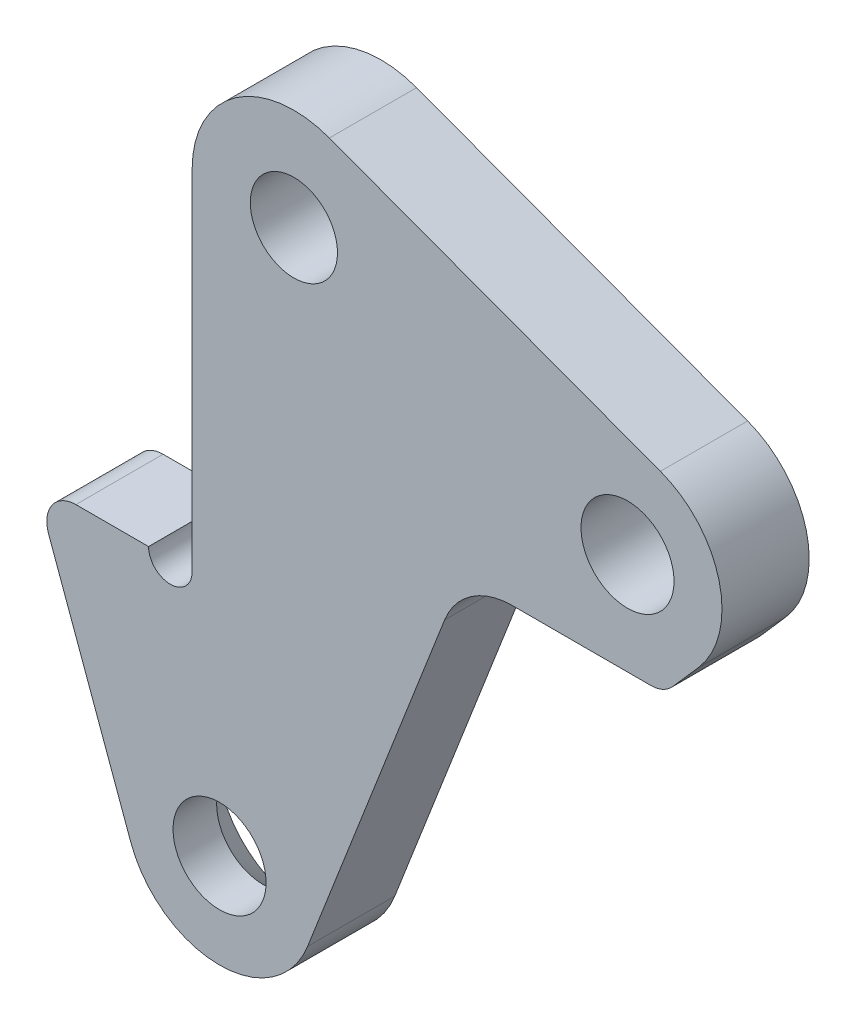
from build123d import *

# Parameters (mm, degrees)
SKETCH_1_R          = 1.5
SKETCH_1_R_2        = 1.6
EXTRUDE_1_DEPTH     = 1.5
CHAMFER_1_SIZE      = 1.5
SKETCH_2_R          = 0.75
CUT_EXTRUDE_1_DEPTH = 28.684874976
CUT_EXTRUDE_2_DEPTH = 28.684874976
FILLET_1_R          = 2.5
FILLET_2_R          = 1


with BuildPart() as part:
    # 草图1 → 凸台-拉伸1 (new, symmetric)
    with BuildSketch(Plane.XY):
        with BuildLine():
            Line((-7.5, -12), (-3.5, -12))
            Line((-3.5, -12), (-3.5, 0))
            ThreePointArc((-3.5, 0), (-1.997674375, 2.873899283), (1.219598337, 3.280637117))
            Line((1.219598337, 3.280637117), (12.609663209, -0.953694105))
            ThreePointArc((12.609663209, -0.953694105), (14.628222296, -3.204119106), (13.92040375, -6.143164253))
            Line((13.92040375, -6.143164253), (-0.114583662, -22.143164253))
            ThreePointArc((-0.114583662, -22.143164253), (-3.157233879, -23.194243112), (-5.61180939, -21.111565466))
            Line((-5.61180939, -21.111565466), (-8.439692621, -13.342020143))
            ThreePointArc((-8.439692621, -13.342020143), (-8.319152044, -12.426423564), (-7.5, -12))
        make_face()
        Circle(SKETCH_1_R, mode=Mode.SUBTRACT)
        with Locations((-2.557808372, -20)):
            Circle(SKETCH_1_R_2, mode=Mode.SUBTRACT)
        with Locations((11.477179039, -4)):
            Circle(SKETCH_1_R_2, mode=Mode.SUBTRACT)
    extrude(amount=EXTRUDE_1_DEPTH, both=True)

    # 倒角1
    chamfer_1_edges = [part.edges().sort_by_distance(p)[0] for p in [
        (-4.157808372, -20, -1.5),
    ]]
    chamfer(chamfer_1_edges, length=CHAMFER_1_SIZE)

    # 草图2 → 切除-拉伸1 (cut, through all)
    with BuildSketch(Plane.XY.offset(1.5)):
        with Locations((-4.25, -12)):
            Circle(SKETCH_2_R)
    extrude(amount=-CUT_EXTRUDE_1_DEPTH, mode=Mode.SUBTRACT)

    # 草图3 → 切除-拉伸2 (cut, through all)
    with BuildSketch(Plane.XY.offset(1.5)):
        with BuildLine():
            Line((5.807426852, -7.5), (12.73020546, -7.5))
            Line((12.73020546, -7.5), (-0.114583662, -22.143164253))
            ThreePointArc((-0.114583662, -22.143164253), (0.219636548, -21.687690646), (0.469932731, -21.181221322))
            Line((0.469932731, -21.181221322), (5.807426852, -7.5))
        make_face()
    extrude(amount=-CUT_EXTRUDE_2_DEPTH, mode=Mode.SUBTRACT)

    # 圆角1
    fillet_1_edges = [part.edges().sort_by_distance(p)[0] for p in [
        (5.807426852, -7.5, 0),
    ]]
    fillet(fillet_1_edges, radius=FILLET_1_R)

    # 圆角2
    fillet_2_edges = [part.edges().sort_by_distance(p)[0] for p in [
        (12.73020546, -7.5, 0),
    ]]
    fillet(fillet_2_edges, radius=FILLET_2_R)


solid = part.part
